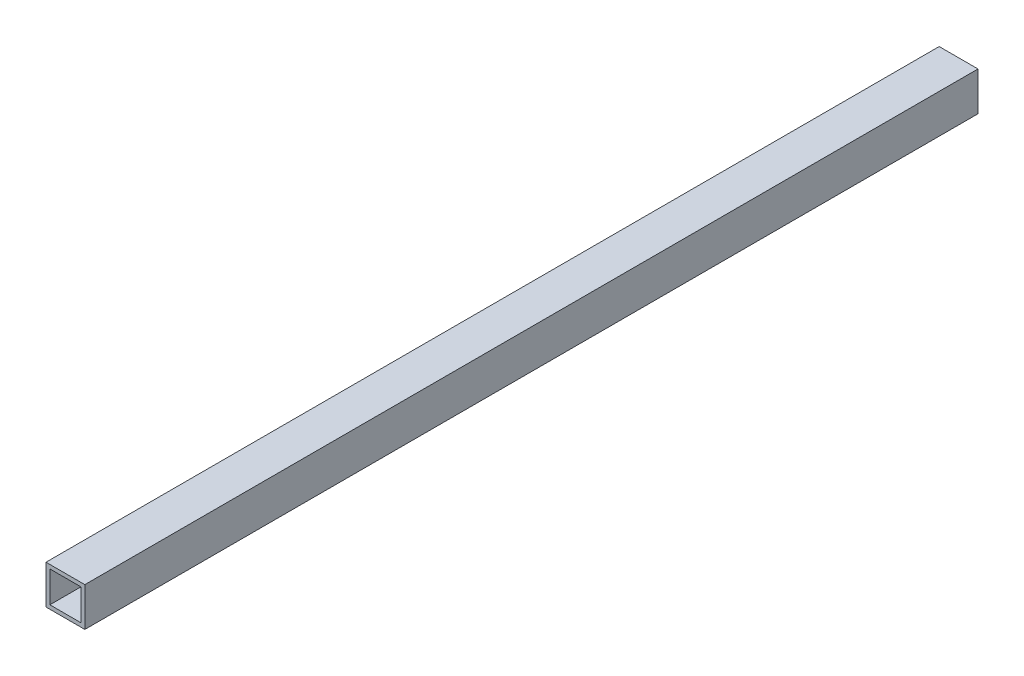
from build123d import *

# Parameters (mm, degrees)
BRACE_TUBE_PROFILE_W   = 20
BRACE_TUBE_PROFILE_H   = 20
BRACE_TUBE_PROFILE_W_2 = 16
BRACE_TUBE_PROFILE_H_2 = 16
BRACE_LENGTH_460_DEPTH = 230


with BuildPart() as part:
    # Brace_Tube_Profile → Brace_Length_460 (new, symmetric)
    with BuildSketch(Plane.XY):
        Rectangle(BRACE_TUBE_PROFILE_W, BRACE_TUBE_PROFILE_H)
        Rectangle(BRACE_TUBE_PROFILE_W_2, BRACE_TUBE_PROFILE_H_2, mode=Mode.SUBTRACT)
    extrude(amount=BRACE_LENGTH_460_DEPTH, both=True)


solid = part.part
